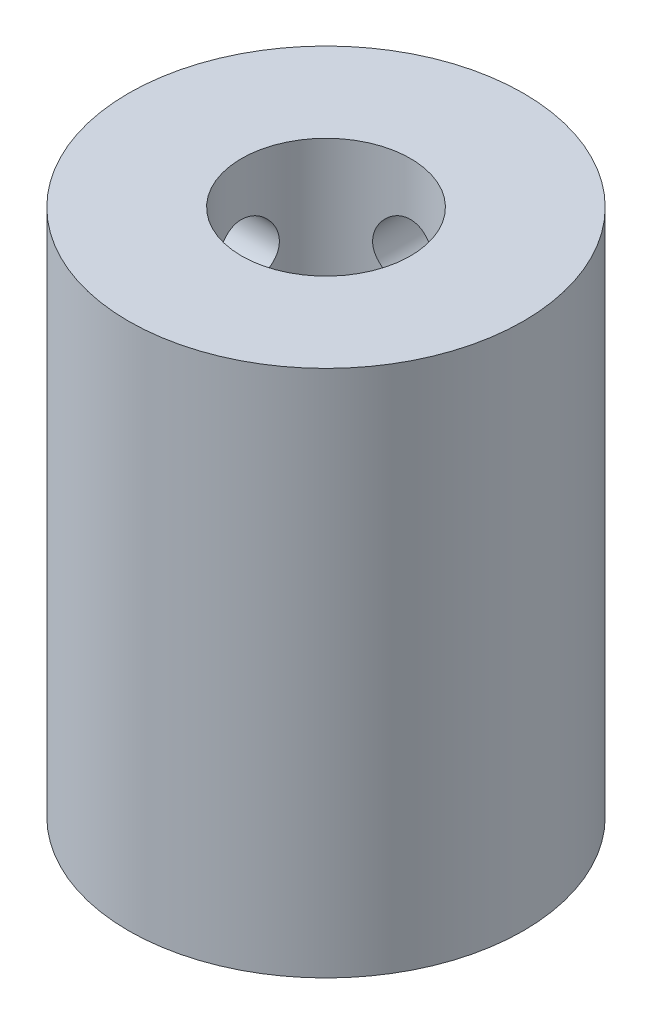
from build123d import *

# Parameters (mm, degrees)
SKETCH1_R           = 9.35
SKETCH1_R_2         = 2.5
BOSS_EXTRUDE1_DEPTH = 25
SKETCH2_R           = 4
CUT_EXTRUDE1_DEPTH  = 12.5
SKETCH3_R           = 1.5
CUT_EXTRUDE2_DEPTH  = 8
CIRPATTERN1_COUNT   = 2
CIRPATTERN1_ANGLE   = 90


with BuildPart() as part:
    # Sketch1 → Boss-Extrude1 (new body)
    with BuildSketch(Plane(origin=(0, 0, 0), x_dir=(1, 0, 0), z_dir=(0, 1, 0))):
        with Locations(Location((0, 0, 0), (0, 0, 270))):
            Circle(SKETCH1_R)
        with Locations(Location((0, 0, 0), (0, 0, 270))):
            Circle(SKETCH1_R_2, mode=Mode.SUBTRACT)
    extrude(amount=BOSS_EXTRUDE1_DEPTH)

    # Sketch2 → Cut-Extrude1 (cut)
    with BuildSketch(Plane(origin=(0, 25, 0), x_dir=(1, 0, 0), z_dir=(0, 1, 0))):
        with Locations(Location((0, 0, 0), (0, 0, 270))):
            Circle(SKETCH2_R)
    extrude(amount=-CUT_EXTRUDE1_DEPTH, mode=Mode.SUBTRACT)

    # Sketch3 → Cut-Extrude2 (cut)
    with BuildSketch(Plane.ZY.offset(9.35)):
        with Locations((0, 21)):
            Circle(SKETCH3_R)
        with Locations((0, 4)):
            Circle(SKETCH3_R)
    cut_extrude2 = extrude(amount=-CUT_EXTRUDE2_DEPTH, mode=Mode.SUBTRACT)

    # CirPattern1: Cut-Extrude2 ×2 about axis
    cirpattern1_axis = Axis((0, 12.5, 0), (0, -1, 0))
    for i in range(1, CIRPATTERN1_COUNT):
        add(cut_extrude2.rotate(cirpattern1_axis, i * CIRPATTERN1_ANGLE / (CIRPATTERN1_COUNT - 1)), mode=Mode.SUBTRACT)


solid = part.part
